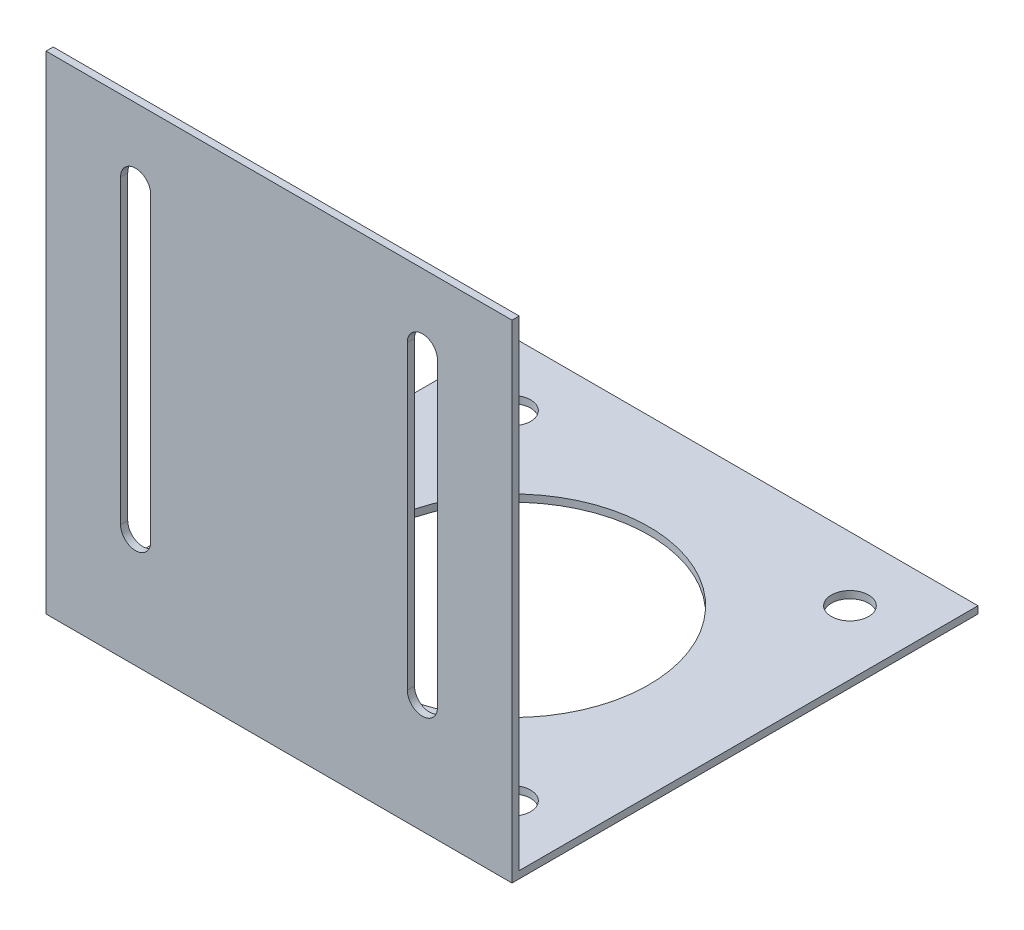
from build123d import *

# Parameters (mm, degrees)
SKETCH_1_W          = 65
SKETCH_1_H          = 65
SKETCH_1_R          = 2.6
SKETCH_1_R_2        = 19.1
EXTRUDE_1_DEPTH     = 1
SKETCH_2_W          = 65
SKETCH_2_H          = 1
EXTRUDE_2_DEPTH     = 67
CUT_EXTRUDE_1_DEPTH = 99.874920986


with BuildPart() as part:
    # 草图1 → 凸台-拉伸1 (new body)
    with BuildSketch(Plane(origin=(0, 0, 0), x_dir=(1, 0, 0), z_dir=(0, 1, 0))):
        Rectangle(SKETCH_1_W, SKETCH_1_H)
        with Locations(Location((-23.57, 23.57, 0), (0, 0, 270))):
            Circle(SKETCH_1_R, mode=Mode.SUBTRACT)
        with Locations(Location((23.57, 23.57, 0), (0, 0, 90))):
            Circle(SKETCH_1_R, mode=Mode.SUBTRACT)
        with Locations(Location((23.57, -23.57, 0), (0, 0, 270))):
            Circle(SKETCH_1_R, mode=Mode.SUBTRACT)
        with Locations(Location((-23.57, -23.57, 0), (0, 0, 90))):
            Circle(SKETCH_1_R, mode=Mode.SUBTRACT)
        with Locations(Location((0, 0, 0), (0, 0, 270))):
            Circle(SKETCH_1_R_2, mode=Mode.SUBTRACT)
    extrude(amount=EXTRUDE_1_DEPTH)

    # 草图2 → 凸台-拉伸2 (add)
    with BuildSketch(Plane(origin=(0, 1, 0), x_dir=(1, 0, 0), z_dir=(0, 1, 0))):
        with Locations((0, -32)):
            Rectangle(SKETCH_2_W, SKETCH_2_H)
    extrude(amount=EXTRUDE_2_DEPTH)

    # 草图3 → 切除-拉伸1 (cut, through all)
    with BuildSketch(Plane(origin=(0, 0, 31.5), x_dir=(-1, 0, 0), z_dir=(0, 0, -1))):
        with BuildLine():
            Line((-17.9, 58), (-17.9, 16))
            ThreePointArc((-17.9, 16), (-20, 13.9), (-22.1, 16))
            Line((-22.1, 16), (-22.1, 58))
            ThreePointArc((-22.1, 58), (-20, 60.1), (-17.9, 58))
        make_face()
        with BuildLine():
            Line((17.9, 58), (17.9, 16))
            ThreePointArc((17.9, 16), (20, 13.9), (22.1, 16))
            Line((22.1, 16), (22.1, 58))
            ThreePointArc((22.1, 58), (20, 60.1), (17.9, 58))
        make_face()
    extrude(amount=-CUT_EXTRUDE_1_DEPTH, mode=Mode.SUBTRACT)


solid = part.part
